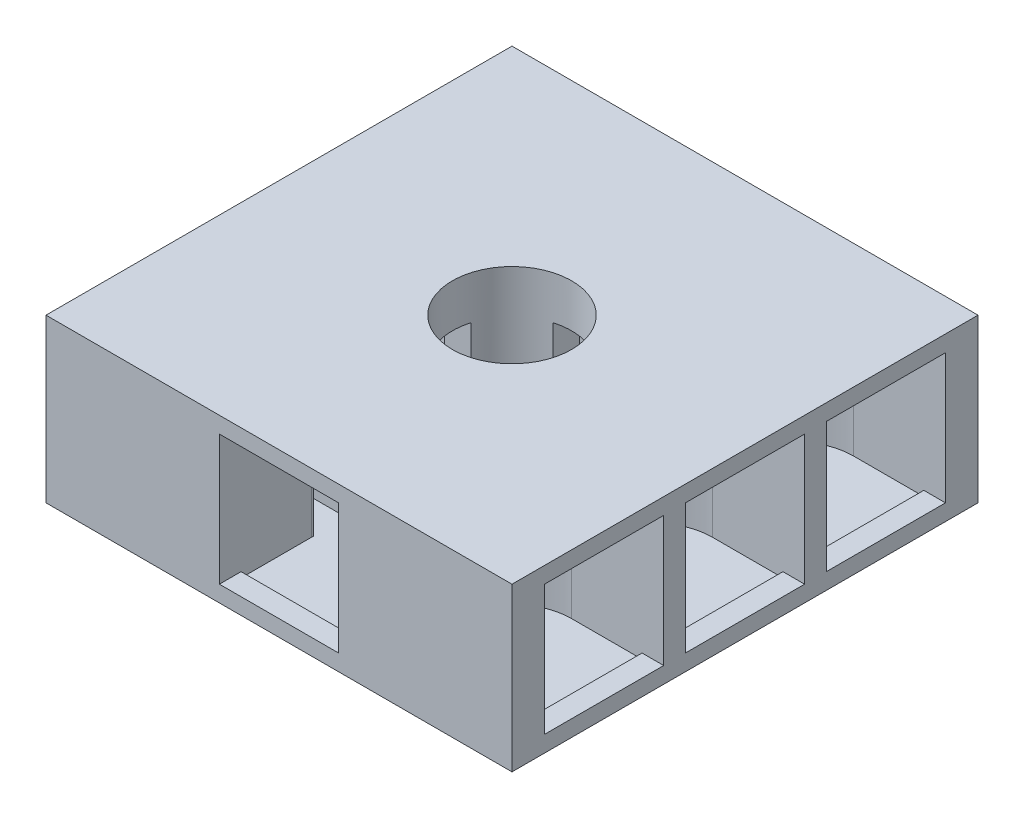
from build123d import *

# Parameters (mm, degrees)
SKETCH1_W           = 8.6
SKETCH1_H           = 8.6
BOSS_EXTRUDE1_DEPTH = 3
CUT_EXTRUDE1_START  = 0.2
SKETCH1_14_R        = 1.1
CUT_EXTRUDE1_DEPTH  = 2.5
CUT_EXTRUDE2_START  = 0.2
SKETCH1_15_R        = 1.1
CUT_EXTRUDE2_DEPTH  = 2.8
BOSS_EXTRUDE2_START = -0.3
SKETCH2_W           = 7.8
SKETCH2_H           = 0.4
SKETCH2_W_2         = 0.4
SKETCH2_H_2         = 7.8
BOSS_EXTRUDE2_DEPTH = 0.1
CUT_EXTRUDE3_START  = -0.2
SKETCH3_W           = 0.6
SKETCH3_H           = 0.162741788
SKETCH3_H_2         = 0.6
CUT_EXTRUDE3_DEPTH  = 2


with BuildPart() as part:
    # Sketch1 → Boss-Extrude1 (new body)
    with BuildSketch(Plane(origin=(0, 0, 0), x_dir=(1, 0, 0), z_dir=(0, 1, 0))):
        with Locations((2.6, 2.6)):
            Rectangle(SKETCH1_W, SKETCH1_H)
    extrude(amount=BOSS_EXTRUDE1_DEPTH)

    # Sketch1<14> → Cut-Extrude1 (cut)
    with BuildSketch(Plane(origin=(0, 0, 0), x_dir=(1, 0, 0), z_dir=(0, 1, 0)).offset(CUT_EXTRUDE1_START)):
        Circle(SKETCH1_14_R)
        with BuildLine():
            Line((0, 1.1), (-1.7, 1.1))
            Line((-1.7, 1.1), (-1.7, -1.1))
            Line((-1.7, -1.1), (-0.1, -1.1))
            Line((-0.1, -1.1), (0, -1.1))
            ThreePointArc((0, -1.1), (-1.1, 0), (0, 1.1))
        make_face()
        with Locations((2.6, 0)):
            Circle(SKETCH1_14_R)
        with BuildLine():
            Line((1.5, -1.7), (3.7, -1.7))
            Line((3.7, -1.7), (3.7, 0))
            ThreePointArc((3.7, 0), (2.6, -1.1), (1.5, 0))
            Line((1.5, 0), (1.5, -1.7))
        make_face()
        with Locations((5.2, 0)):
            Circle(SKETCH1_14_R)
        with BuildLine():
            Line((6.9, -1.1), (6.9, 1.1))
            Line((6.9, 1.1), (5.2, 1.1))
            ThreePointArc((5.2, 1.1), (5.977817459, 0.777817459), (6.3, 0))
            ThreePointArc((6.3, 0), (5.977817459, -0.777817459), (5.2, -1.1))
            Line((5.2, -1.1), (6.9, -1.1))
        make_face()
        with BuildLine():
            Line((6.9, 1.5), (6.9, 3.7))
            Line((6.9, 3.7), (5.2, 3.7))
            ThreePointArc((5.2, 3.7), (5.977817459, 3.377817459), (6.3, 2.6))
            ThreePointArc((6.3, 2.6), (5.977817459, 1.822182541), (5.2, 1.5))
            Line((5.2, 1.5), (6.9, 1.5))
        make_face()
        with Locations((5.2, 2.6)):
            Circle(SKETCH1_14_R)
        with BuildLine():
            Line((6.9, 4.1), (6.9, 6.3))
            Line((6.9, 6.3), (5.2, 6.3))
            ThreePointArc((5.2, 6.3), (5.977817459, 5.977817459), (6.3, 5.2))
            ThreePointArc((6.3, 5.2), (5.977817459, 4.422182541), (5.2, 4.1))
            Line((5.2, 4.1), (6.9, 4.1))
        make_face()
        with Locations((5.2, 5.2)):
            Circle(SKETCH1_14_R)
        with BuildLine():
            Line((3.7, 5.2), (3.7, 6.9))
            Line((3.7, 6.9), (1.5, 6.9))
            Line((1.5, 6.9), (1.5, 5.2))
            ThreePointArc((1.5, 5.2), (2.6, 6.3), (3.7, 5.2))
        make_face()
        with Locations((2.6, 5.2)):
            Circle(SKETCH1_14_R)
        with Locations((0, 2.6)):
            Circle(SKETCH1_14_R)
        with BuildLine():
            Line((0, 3.7), (-1.7, 3.7))
            Line((-1.7, 3.7), (-1.7, 1.5))
            Line((-1.7, 1.5), (0, 1.5))
            ThreePointArc((0, 1.5), (-1.1, 2.6), (0, 3.7))
        make_face()
        with BuildLine():
            Line((-0.9, 6.3), (-1.7, 6.3))
            Line((-1.7, 6.3), (-1.7, 4.1))
            Line((-1.7, 4.1), (0, 4.1))
            ThreePointArc((0, 4.1), (-1.1, 5.2), (0, 6.3))
            Line((0, 6.3), (-0.9, 6.3))
        make_face()
        with Locations((0, 5.2)):
            Circle(SKETCH1_14_R)
    extrude(amount=CUT_EXTRUDE1_DEPTH, mode=Mode.SUBTRACT)

    # Sketch1<15> → Cut-Extrude2 (cut)
    with BuildSketch(Plane(origin=(0, 0, 0), x_dir=(1, 0, 0), z_dir=(0, 1, 0)).offset(CUT_EXTRUDE2_START)):
        with Locations(Location((2.6, 2.6, 0), (0, 0, 270))):
            Circle(SKETCH1_15_R)
    extrude(amount=CUT_EXTRUDE2_DEPTH, mode=Mode.SUBTRACT)

    # Sketch2 → Boss-Extrude2 (add)
    with BuildSketch(Plane.XZ.offset(BOSS_EXTRUDE2_START)):
        with Locations((2.6, 1.5)):
            Rectangle(SKETCH2_W, SKETCH2_H)
        with Locations((-1.5, -2.6)):
            Rectangle(SKETCH2_W_2, SKETCH2_H_2)
        with Locations((2.6, -6.7)):
            Rectangle(SKETCH2_W, SKETCH2_H)
        with Locations((6.7, -2.6)):
            Rectangle(SKETCH2_W_2, SKETCH2_H_2)
    extrude(amount=BOSS_EXTRUDE2_DEPTH)

    # Sketch3 → Cut-Extrude3 (cut)
    with BuildSketch(Plane.XZ.offset(CUT_EXTRUDE3_START)):
        Polygon((0.476549662, -0.03929145), (0.476549662, -0.591206698), (0.874813971, -0.246872241), (1.214094825, -0.63929145), (2.3, -0.63929145), (2.3, -0.476549662), (2.9, -0.476549662), (2.9, -0.63929145), (3.985905175, -0.63929145), (4.325186029, -0.246872241), (4.723450338, -0.591206698), (4.723450338, -0.03929145), align=None)
        with Locations((2.6, -0.557920556)):
            Rectangle(SKETCH3_W, SKETCH3_H)
        Polygon((0.874813971, -0.246872241), (0.476549662, -0.591206698), (0.476549662, -0.63929145), (1.214094825, -0.63929145), align=None)
        Polygon((4.325186029, -0.246872241), (3.985905175, -0.63929145), (4.723450338, -0.63929145), (4.723450338, -0.591206698), align=None)
        Polygon((3.343237824, -2.3), (2.9, -2.3), (2.9, -2.9), (3.304728308, -2.9), (4.723450338, -2.9), (4.723450338, -2.3), align=None)
        with Locations((2.6, -2.6)):
            Rectangle(SKETCH3_W, SKETCH3_H_2)
        Polygon((2.3, -2.3), (1.856762176, -2.3), (0.476549662, -2.3), (0.476549662, -2.9), (1.856762176, -2.9), (2.3, -2.9), align=None)
        Polygon((2.9, -2.9), (2.3, -2.9), (2.3, -3.304728308), (2.3, -4.56070855), (2.9, -4.56070855), (2.9, -3.343237824), align=None)
        Polygon((2.3, -1.895271692), (2.3, -2.3), (2.9, -2.3), (2.9, -1.895271692), (2.9, -0.63929145), (2.3, -0.63929145), align=None)
        with Locations((2.6, -4.642079444)):
            Rectangle(SKETCH3_W, SKETCH3_H)
        Polygon((2.3, -4.723450338), (2.3, -4.56070855), (1.214094825, -4.56070855), (0.874813971, -4.953127759), (0.476549662, -4.608793302), (0.476549662, -5.16070855), (4.723450338, -5.16070855), (4.723450338, -4.590835654), (4.56070855, -4.779066151), (4.308151662, -4.56070855), (2.9, -4.56070855), (2.9, -4.723450338), align=None)
        Polygon((0.874813971, -4.953127759), (1.214094825, -4.56070855), (0.476549662, -4.56070855), (0.476549662, -4.608793302), align=None)
        Polygon((4.723450338, -4.56070855), (4.308151662, -4.56070855), (4.56070855, -4.779066151), (4.723450338, -4.590835654), align=None)
    extrude(amount=-CUT_EXTRUDE3_DEPTH, mode=Mode.SUBTRACT)


solid = part.part
